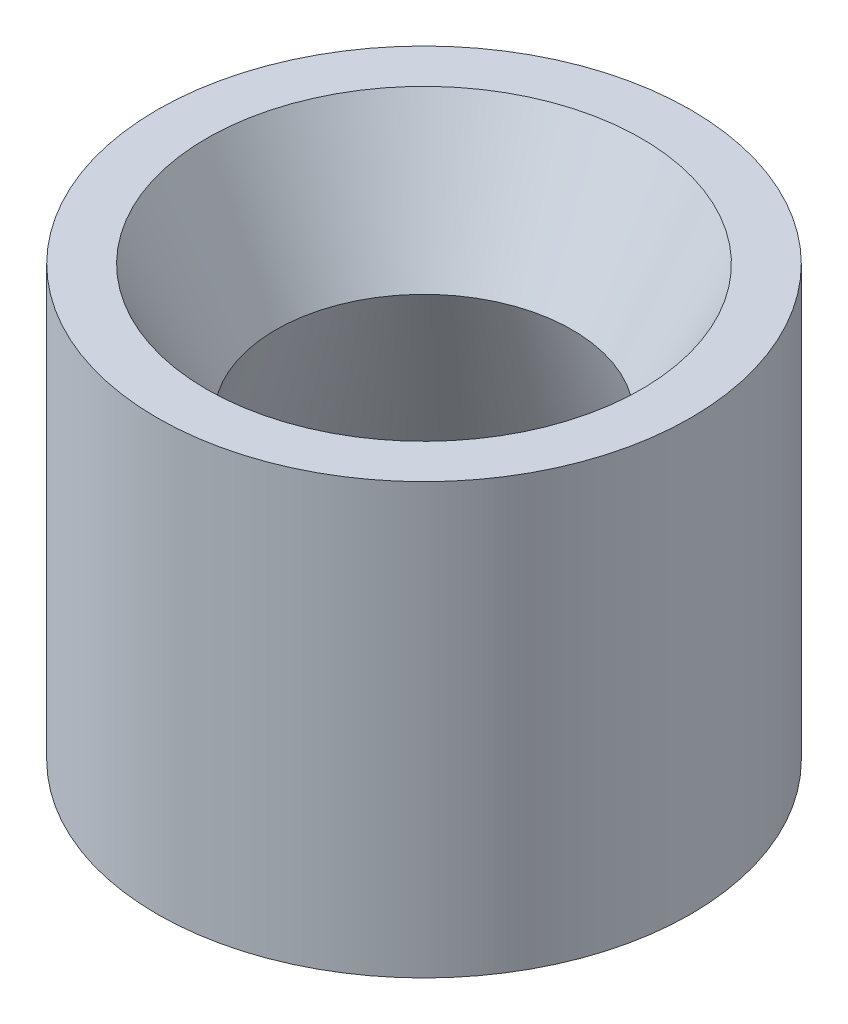
from build123d import *


with BuildPart() as part:
    # Sketch1 → Revolve1 (revolve)
    with BuildSketch(Plane.XY, mode=Mode.PRIVATE) as revolve1_sk:
        Polygon((-27.94, 0), (-34.29, 0), (-34.29, -55.245), (-33.02, -55.245), (-19.05, -16.86274045), align=None)
    revolve(revolve1_sk.sketch.rotate(Axis((0, 0, 0), (0, -1, 0)), 270), axis=Axis((0, 0, 0), (0, -1, 0)))


solid = part.part
